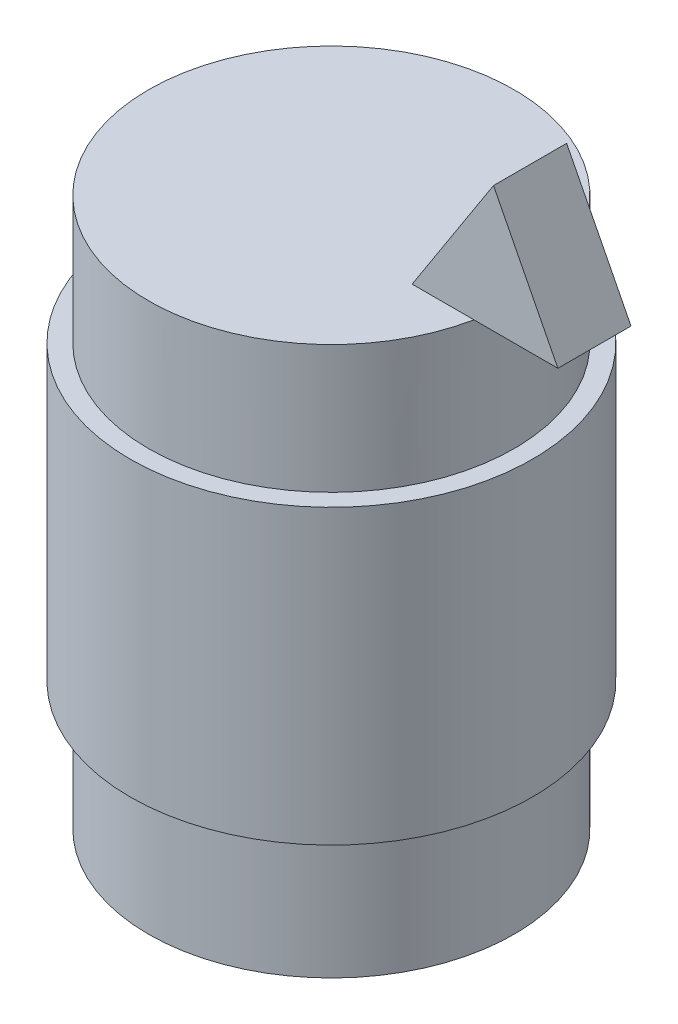
from build123d import *

# Parameters (mm, degrees)
SKETCH_1_R      = 5
EXTRUDE_1_DEPTH = 7.5
SKETCH_2_R      = 5.5
EXTRUDE_2_DEPTH = 4
EXTRUDE_3_DEPTH = 1
SCALE_1_SCALE   = 3
SCALE_2_SCALE   = 0.7


with BuildPart() as part:
    # 草图1 → 凸台-拉伸1 (new, symmetric)
    with BuildSketch(Plane(origin=(0, 0, 0), x_dir=(1, 0, 0), z_dir=(0, 1, 0))):
        with Locations(Location((0, 0, 0), (0, 0, 270))):
            Circle(SKETCH_1_R)
    extrude(amount=EXTRUDE_1_DEPTH, both=True)

    # 草图2 → 凸台-拉伸2 (add, symmetric)
    with BuildSketch(Plane(origin=(0, 0, 0), x_dir=(1, 0, 0), z_dir=(0, 1, 0))):
        with Locations(Location((0, 0, 0), (0, 0, 270))):
            Circle(SKETCH_2_R)
    extrude(amount=EXTRUDE_2_DEPTH, both=True)

    # 草图3 → 凸台-拉伸3 (add, symmetric)
    with BuildSketch(Plane.XY):
        Polygon((3.208751117, 7.5), (7.19369463, 7.5), (5.433428229, 10.94766776), align=None)
    extrude(amount=EXTRUDE_3_DEPTH, both=True)


with BuildPart() as part_1:
    # 缩放比例1: scaled about (0.054783729, 0.089765176, 0)
    add(part.part.scale(SCALE_1_SCALE).moved(Location((-0.109567458, -0.179530352, 0))))


with BuildPart() as part_2:
    # 缩放比例2: scaled about (0.05478373, 0.089765175, 0)
    add(part_1.part.scale(SCALE_2_SCALE).moved(Location((0.016435119, 0.026929553, 0))))


solid = part_2.part
